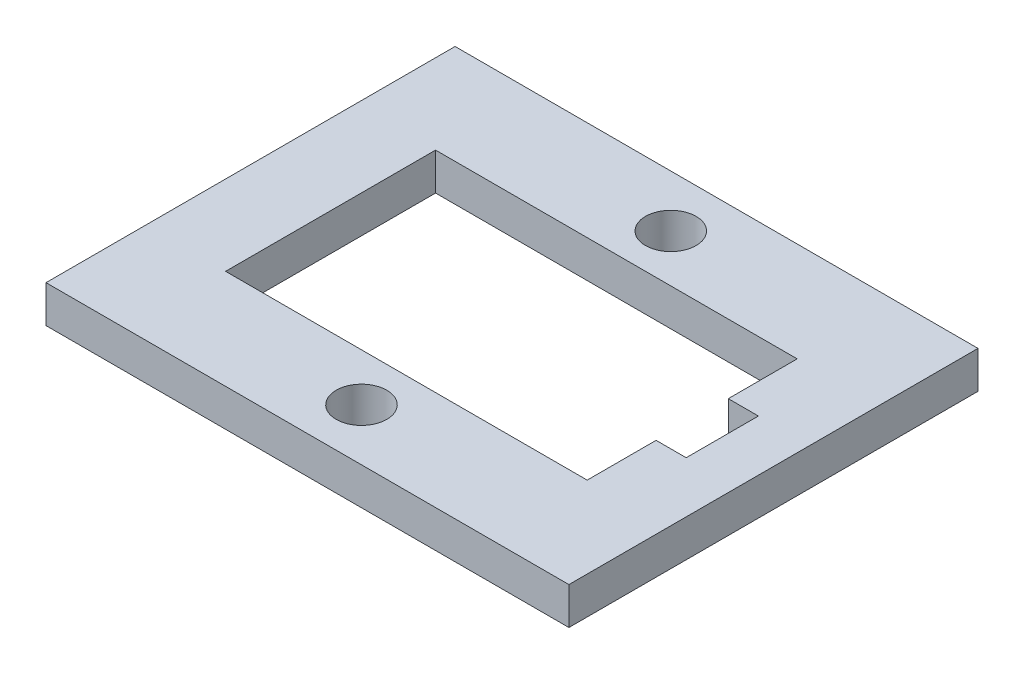
from build123d import *

# Parameters (mm, degrees)
SKETCH2_W           = 35.12443
SKETCH2_H           = 27.47815276
SKETCH2_R           = 1.7
BOSS_EXTRUDE2_DEPTH = 2.5


with BuildPart() as part:
    # Sketch2 → Boss-Extrude2 (new body)
    with BuildSketch(Plane(origin=(0, 0, 0), x_dir=(1, 0, 0), z_dir=(0, 1, 0))):
        with Locations((-0.139276638, 0.7775026)):
            Rectangle(SKETCH2_W, SKETCH2_H)
        with Locations(Location((0.275439535, 11.02885898, 0), (0, 0, 270))):
            Circle(SKETCH2_R, mode=Mode.SUBTRACT)
        with Locations(Location((0, -9.47157378, 0), (0, 0, 270))):
            Circle(SKETCH2_R, mode=Mode.SUBTRACT)
        Polygon((-12.329001638, 7.83354898), (11.960588362, 7.83354898), (11.960588362, 3.2058826), (13.982538362, 3.2058826), (13.982538362, -1.6439074), (11.960588362, -1.6439074), (11.960588362, -6.27157378), (-12.329001638, -6.27157378), align=None, mode=Mode.SUBTRACT)
    extrude(amount=BOSS_EXTRUDE2_DEPTH)


solid = part.part
